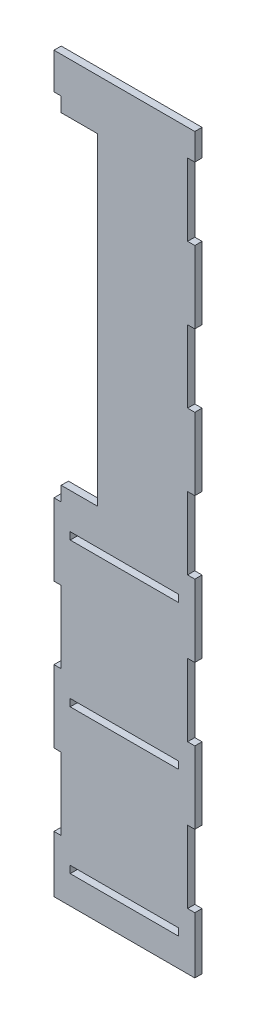
from build123d import *

# Parameters (mm, degrees)
SKETCH_1_W      = 30
SKETCH_1_H      = 2
EXTRUDE_2_DEPTH = 2


with BuildPart() as part:
    # 草图1 → 凸台-拉伸2 (new body)
    with BuildSketch(Plane.XY):
        Polygon((-8, 49), (-8, 45), (2, 45), (2, 33.89311496), (2, -33.9722289), (2, -44.34252785), (-8, -44.34252785), (-8, -48.34252785), (-10, -48.34252785), (-10, -68.34252785), (-8, -68.34252785), (-8, -88.34252785), (-10, -88.34252785), (-10, -108.34252785), (-8, -108.34252785), (-8, -128.34252785), (-10, -128.34252785), (-10, -144), (-8, -144), (27, -144), (29, -144), (29, -128.34252785), (27, -128.34252785), (27, -108.34252785), (29, -108.34252785), (29, -88.34252785), (27, -88.34252785), (27, -68.34252785), (29, -68.34252785), (29, -48.34252785), (27, -48.34252785), (27, -28.34252785), (29, -28.34252785), (29, -8.34252785), (27, -8.34252785), (27, 11.65747215), (29, 11.65747215), (29, 31.65747215), (27, 31.65747215), (27, 51.65747215), (29, 51.65747215), (29, 59), (-10, 59), (-10, 49), align=None)
        Polygon((9.5, -54.22154055), (24.5, -54.22154055), (24.5, -56.22154055), (-5.5, -56.22154055), (-5.5, -54.22154055), align=None, mode=Mode.SUBTRACT)
        with Locations((9.5, -95.22154055)):
            Rectangle(SKETCH_1_W, SKETCH_1_H, mode=Mode.SUBTRACT)
        with Locations((9.5, -135.22154055)):
            Rectangle(SKETCH_1_W, SKETCH_1_H, mode=Mode.SUBTRACT)
    extrude(amount=EXTRUDE_2_DEPTH)


solid = part.part
